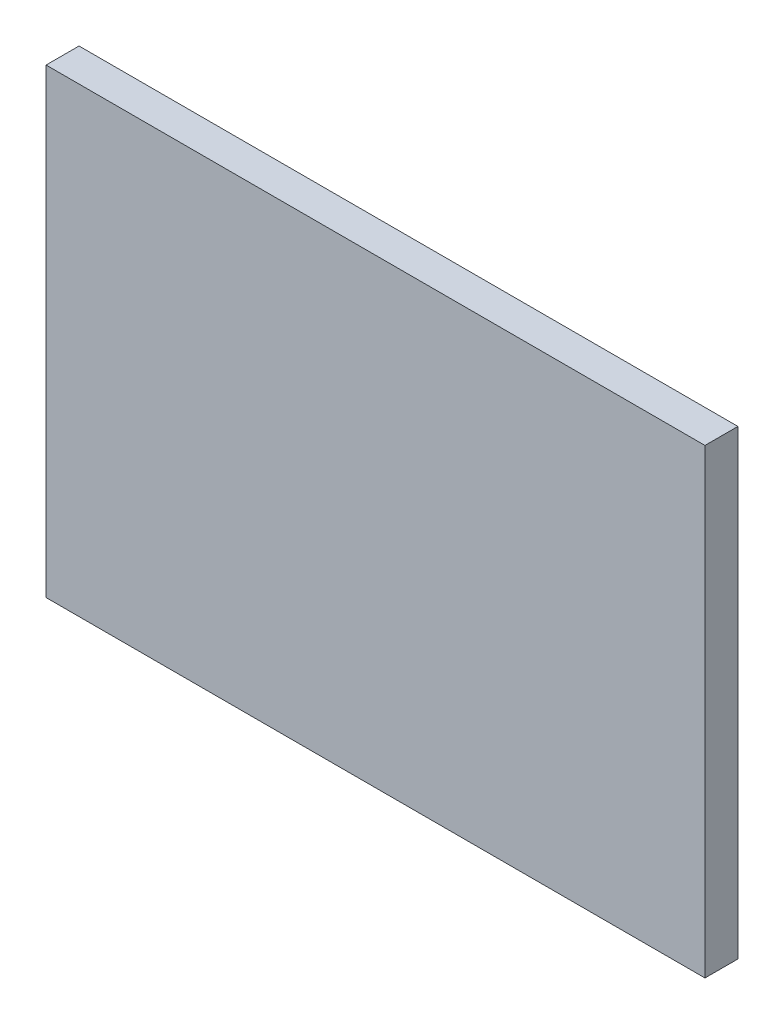
from build123d import *

# Parameters (mm, degrees)
ESQUISSE1_W        = 40
ESQUISSE1_H        = 28
BOSS_EXTRU_1_DEPTH = 2


with BuildPart() as part:
    # Esquisse1 → Boss.-Extru.1 (new body)
    with BuildSketch(Plane.XY):
        Rectangle(ESQUISSE1_W, ESQUISSE1_H)
    extrude(amount=BOSS_EXTRU_1_DEPTH)


solid = part.part
